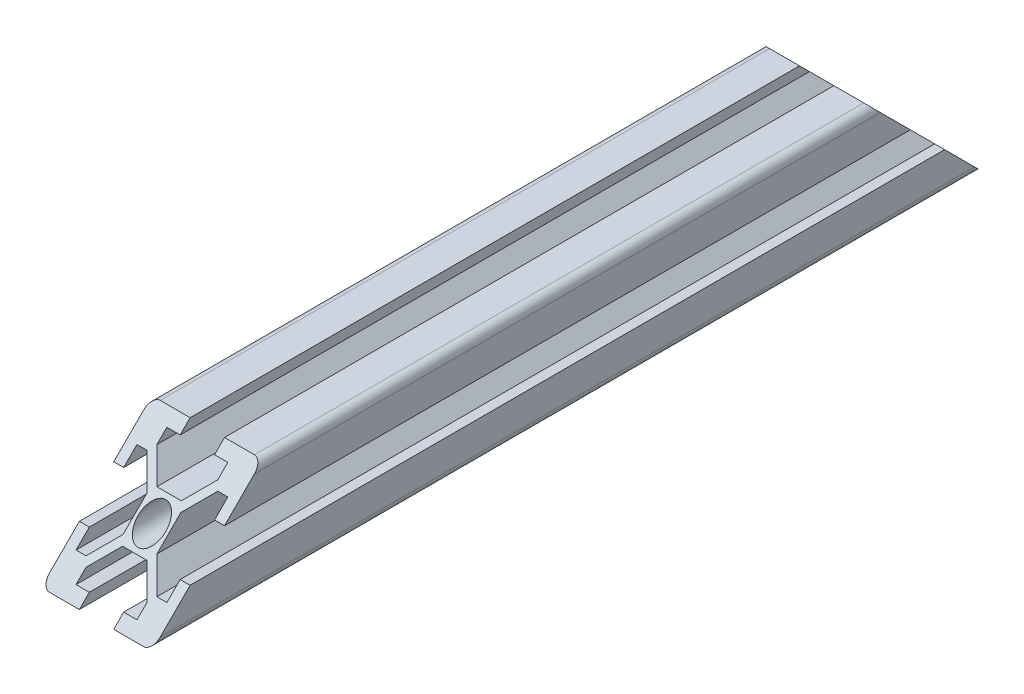
from build123d import *

# Parameters (mm, degrees)
SKETCH_1_R          = 2.5
EXTRUDE_1_DEPTH     = 150
CUT_EXTRUDE_1_DEPTH = 153.242379078


with BuildPart() as part:
    # 草图1 → 凸台-拉伸1 (new body)
    with BuildSketch(Plane.XY):
        with BuildLine():
            Line((-25.95624704, -9.765592916), (-27.75624704, -9.765592916))
            Line((-27.75624704, -9.765592916), (-27.75624704, -15.165592916))
            ThreePointArc((-27.75624704, -15.165592916), (-27.316907212, -16.226253087), (-26.25624704, -16.665592916))
            Line((-26.25624704, -16.665592916), (-20.85624704, -16.665592916))
            Line((-20.85624704, -16.665592916), (-20.85624704, -14.865592916))
            Line((-20.85624704, -14.865592916), (-23.25624704, -14.865592916))
            Line((-23.25624704, -14.865592916), (-23.25624704, -13.062643071))
            Line((-23.25624704, -13.062643071), (-19.959196885, -9.765592916))
            Line((-19.959196885, -9.765592916), (-15.553297195, -9.765592916))
            Line((-15.553297195, -9.765592916), (-12.25624704, -13.062643071))
            Line((-12.25624704, -13.062643071), (-12.25624704, -14.865592916))
            Line((-12.25624704, -14.865592916), (-14.65624704, -14.865592916))
            Line((-14.65624704, -14.865592916), (-14.65624704, -16.665592916))
            Line((-14.65624704, -16.665592916), (-9.25624704, -16.665592916))
            ThreePointArc((-9.25624704, -16.665592916), (-8.195586868, -16.226253087), (-7.75624704, -15.165592916))
            Line((-7.75624704, -15.165592916), (-7.75624704, -9.765592916))
            Line((-7.75624704, -9.765592916), (-9.55624704, -9.765592916))
            Line((-9.55624704, -9.765592916), (-9.55624704, -12.165592916))
            Line((-9.55624704, -12.165592916), (-11.359196885, -12.165592916))
            Line((-11.359196885, -12.165592916), (-14.70212002, -8.822669781))
            Line((-14.70212002, -8.822669781), (-14.70212002, -4.50851605))
            Line((-14.70212002, -4.50851605), (-11.359196885, -1.165592916))
            Line((-11.359196885, -1.165592916), (-9.55624704, -1.165592916))
            Line((-9.55624704, -1.165592916), (-9.55624704, -3.565592916))
            Line((-9.55624704, -3.565592916), (-7.75624704, -3.565592916))
            Line((-7.75624704, -3.565592916), (-7.75624704, 1.834407084))
            ThreePointArc((-7.75624704, 1.834407084), (-8.195586868, 2.895067256), (-9.25624704, 3.334407084))
            Line((-9.25624704, 3.334407084), (-14.65624704, 3.334407084))
            Line((-14.65624704, 3.334407084), (-14.65624704, 1.534407084))
            Line((-14.65624704, 1.534407084), (-12.25624704, 1.534407084))
            Line((-12.25624704, 1.534407084), (-12.25624704, -0.26854276))
            Line((-12.25624704, -0.26854276), (-15.553297195, -3.565592916))
            Line((-15.553297195, -3.565592916), (-19.959196885, -3.565592916))
            Line((-19.959196885, -3.565592916), (-23.25624704, -0.26854276))
            Line((-23.25624704, -0.26854276), (-23.25624704, 1.534407084))
            Line((-23.25624704, 1.534407084), (-20.85624704, 1.534407084))
            Line((-20.85624704, 1.534407084), (-20.85624704, 3.334407084))
            Line((-20.85624704, 3.334407084), (-26.25624704, 3.334407084))
            ThreePointArc((-26.25624704, 3.334407084), (-27.316907212, 2.895067256), (-27.75624704, 1.834407084))
            Line((-27.75624704, 1.834407084), (-27.75624704, -3.565592916))
            Line((-27.75624704, -3.565592916), (-25.95624704, -3.565592916))
            Line((-25.95624704, -3.565592916), (-25.95624704, -1.165592916))
            Line((-25.95624704, -1.165592916), (-24.153297195, -1.165592916))
            Line((-24.153297195, -1.165592916), (-20.81037406, -4.50851605))
            Line((-20.81037406, -4.50851605), (-20.81037406, -8.822669781))
            Line((-20.81037406, -8.822669781), (-24.153297195, -12.165592916))
            Line((-24.153297195, -12.165592916), (-25.95624704, -12.165592916))
            Line((-25.95624704, -12.165592916), (-25.95624704, -9.765592916))
        make_face()
        with Locations((-17.75624704, -6.665592916)):
            Circle(SKETCH_1_R, mode=Mode.SUBTRACT)
    extrude(amount=EXTRUDE_1_DEPTH)

    # 草图2 → 切除-拉伸1 (cut, through all)
    with BuildSketch(Plane.ZY.offset(27.75624704)):
        Polygon((0, -16.665592916), (20, 3.334407084), (0, 3.334407084), align=None)
        Polygon((150, -16.665592916), (130, 3.334407084), (150, 3.334407084), align=None)
    extrude(amount=-CUT_EXTRUDE_1_DEPTH, mode=Mode.SUBTRACT)


solid = part.part
